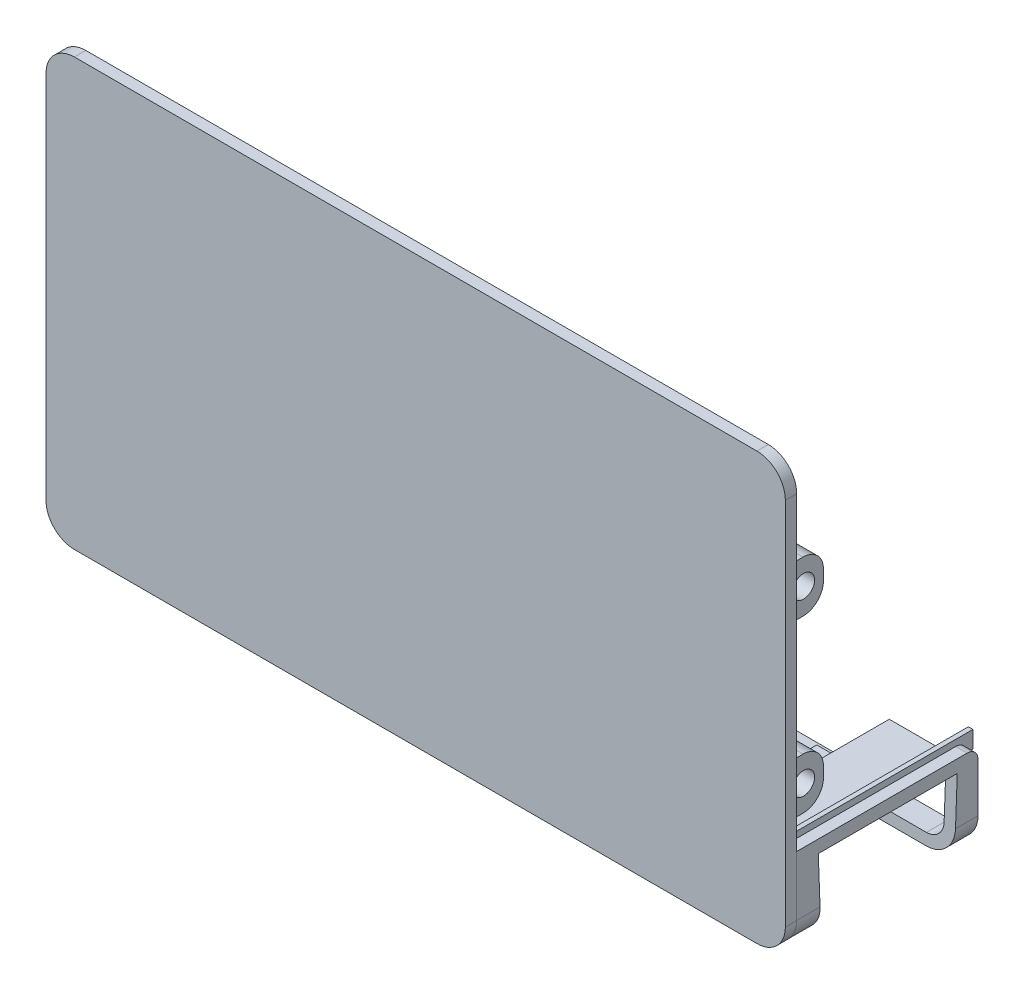
from build123d import *

# Parameters (mm, degrees)
FLAT_BOTTOM_COVER_T2_DEPTH           = 2
SKETCH_26_W                          = 6.4
SKETCH_26_H                          = 9
SIDE_LOCK_EARS_1_DEPTH               = 7
SKETCH_27_W                          = 6.4
SKETCH_27_H                          = 9
SIDE_LOCK_EARS_1_2_DEPTH             = 7
SKETCH_28_R                          = 1.45
SCREW_TIP_RELIEF_D2_9_1_DEPTH        = 5.6
SKETCH_29_R                          = 1.95
M2_5_HEATSET_D3_9_DEPTH3_5_1_DEPTH   = 3.5
SCREW_TIP_RELIEF_D2_9_1_START        = -5.6
SKETCH_30_R                          = 1.45
SCREW_TIP_RELIEF_D2_9_1_2_DEPTH      = 5.6
M2_5_HEATSET_D3_9_DEPTH3_5_1_START   = -3.5
SKETCH_31_R                          = 1.95
M2_5_HEATSET_D3_9_DEPTH3_5_1_2_DEPTH = 3.5
FILLET_1_R                           = 3.6
EXTRUDE_2_DEPTH                      = 31.9
FILLET_2_R                           = 1.9
CUT_EXTRUDE_1_DEPTH                  = 17
SKETCH_36_W                          = 10
SKETCH_36_H                          = 2.230124649
SKETCH_36_W_2                        = 7.730192546
SKETCH_36_H_2                        = 3.216563854
EXTRUDE_3_DEPTH                      = 28.3
SKETCH_38_R                          = 2
CUT_EXTRUDE_2_DEPTH                  = 3.4
SKETCH_39_W                          = 0.8
SKETCH_39_H                          = 3
EXTRUDE_4_DEPTH                      = 33
SKETCH_40_R                          = 1
CUT_EXTRUDE_3_DEPTH                  = 2
EXTRUDE_5_DEPTH                      = 1.5
SKETCH_42_W                          = 1.5
SKETCH_42_H                          = 31.9
EXTRUDE_6_DEPTH                      = 1.5
CHAMFER_1_SIZE                       = 1.5
SKETCH_43_W                          = 30
SKETCH_43_H                          = 10.5
CUT_EXTRUDE_4_DEPTH                  = 30


with BuildPart() as part:
    # 草图25 → Flat_bottom_cover_T2 (new body)
    with BuildSketch(Plane.XY):
        with BuildLine():
            Line((-60, -37.5), (60, -37.5))
            ThreePointArc((60, -37.5), (63.535533906, -36.035533906), (65, -32.5))
            Line((65, -32.5), (65, 32.5))
            ThreePointArc((65, 32.5), (63.535533906, 36.035533906), (60, 37.5))
            Line((60, 37.5), (-60, 37.5))
            ThreePointArc((-60, 37.5), (-63.535533906, 36.035533906), (-65, 32.5))
            Line((-65, 32.5), (-65, -32.5))
            ThreePointArc((-65, -32.5), (-63.535533906, -36.035533906), (-60, -37.5))
        make_face()
    extrude(amount=FLAT_BOTTOM_COVER_T2_DEPTH)

    # 草图26 → Side_lock_ears_-1 (add)
    with BuildSketch(Plane.XY):
        with Locations((-59.5, -14.5)):
            Rectangle(SKETCH_26_W, SKETCH_26_H)
        with Locations((-59.5, 15.5)):
            Rectangle(SKETCH_26_W, SKETCH_26_H)
    extrude(amount=-SIDE_LOCK_EARS_1_DEPTH)

    # 草图27 → Side_lock_ears_1 2 (add)
    with BuildSketch(Plane.XY):
        with Locations((59.5, -14.5)):
            Rectangle(SKETCH_27_W, SKETCH_27_H)
        with Locations((59.5, 15.5)):
            Rectangle(SKETCH_27_W, SKETCH_27_H)
    extrude(amount=-SIDE_LOCK_EARS_1_2_DEPTH)

    # 草图28 → Screw_tip_relief_D2.9_-1 (cut)
    with BuildSketch(Plane.ZY.offset(62.7)):
        with Locations((-3.5, -14.5)):
            Circle(SKETCH_28_R)
        with Locations((-3.5, 15.5)):
            Circle(SKETCH_28_R)
    extrude(amount=-SCREW_TIP_RELIEF_D2_9_1_DEPTH, mode=Mode.SUBTRACT)

    # 草图29 → M2.5_heatset_D3.9_depth3.5_-1 (cut)
    with BuildSketch(Plane.ZY.offset(62.7)):
        with Locations((-3.5, -14.5)):
            Circle(SKETCH_29_R)
        with Locations((-3.5, 15.5)):
            Circle(SKETCH_29_R)
    extrude(amount=-M2_5_HEATSET_D3_9_DEPTH3_5_1_DEPTH, mode=Mode.SUBTRACT)

    # 草图30 → Screw_tip_relief_D2.9_1 2 (cut)
    with BuildSketch(Plane(origin=(62.7, 0, 0), x_dir=(0, 0, -1), z_dir=(1, 0, 0)).offset(SCREW_TIP_RELIEF_D2_9_1_START)):
        with Locations(Location((3.5, -14.5, 0), (0, 0, 180))):
            Circle(SKETCH_30_R)
        with Locations(Location((3.5, 15.5, 0), (0, 0, 180))):
            Circle(SKETCH_30_R)
    extrude(amount=SCREW_TIP_RELIEF_D2_9_1_2_DEPTH, mode=Mode.SUBTRACT)

    # 草图31 → M2.5_heatset_D3.9_depth3.5_1 2 (cut)
    with BuildSketch(Plane(origin=(62.7, 0, 0), x_dir=(0, 0, -1), z_dir=(1, 0, 0)).offset(M2_5_HEATSET_D3_9_DEPTH3_5_1_START)):
        with Locations(Location((3.5, -14.5, 0), (0, 0, 180))):
            Circle(SKETCH_31_R)
        with Locations(Location((3.5, 15.5, 0), (0, 0, 180))):
            Circle(SKETCH_31_R)
    extrude(amount=M2_5_HEATSET_D3_9_DEPTH3_5_1_2_DEPTH, mode=Mode.SUBTRACT)

    # 圆角1
    fillet_1_edges = [part.edges().sort_by_distance(p)[0] for p in [
        (-59.5, -10, -7),
        (-59.5, -19, -7),
        (-59.5, 20, -7),
        (-59.5, 11, -7),
        (59.5, -10, -7),
        (59.5, -19, -7),
        (59.5, 20, -7),
        (59.5, 11, -7),
    ]]
    fillet(fillet_1_edges, radius=FILLET_1_R)

    # 草图34 → 凸台-拉伸2 (add)
    with BuildSketch(Plane(origin=(0, 0, 0), x_dir=(-1, 0, 0), z_dir=(0, 0, -1))):
        with BuildLine():
            Line((59.9, -37.5), (59.9, -35.5))
            Line((59.9, -35.5), (-59.974798431, -35.5))
            ThreePointArc((-59.974798431, -35.5), (-62.096118775, -34.621320344), (-62.974798431, -32.5))
            Line((-62.974798431, -32.5), (-62.974798431, -22))
            Line((-62.974798431, -22), (-64.974798431, -22))
            Line((-64.974798431, -22), (-64.974798431, -32.5))
            ThreePointArc((-64.974798431, -32.5), (-63.510332337, -36.035533906), (-59.974798431, -37.5))
            Line((-59.974798431, -37.5), (59.9, -37.5))
        make_face()
    extrude(amount=EXTRUDE_2_DEPTH)

    # 圆角2
    fillet_2_edges = [part.edges().sort_by_distance(p)[0] for p in [
        (-59.9, -36.5, -31.9),
        (63.974798431, -22, -31.9),
    ]]
    fillet(fillet_2_edges, radius=FILLET_2_R)

    # 草图35 → 切除-拉伸1 (cut)
    with BuildSketch(Plane(origin=(64.974798431, 0, 0), x_dir=(0, 0, -1), z_dir=(1, 0, 0))):
        Polygon((28.253330829, -24.230124649), (3.818816185, -24.230124649), (4.460921325, -41.414522636), (27.608915905, -41.414522636), align=None)
    extrude(amount=-CUT_EXTRUDE_1_DEPTH, mode=Mode.SUBTRACT)

    # 草图36 → 凸台-拉伸3 (add)
    with BuildSketch(Plane(origin=(0, 0, 0), x_dir=(-1, 0, 0), z_dir=(0, 0, -1))):
        with Locations((-57.974798431, -23.115062325)):
            Rectangle(SKETCH_36_W, SKETCH_36_H)
        with Locations((-44.107402927, -33.891718073)):
            Rectangle(SKETCH_36_W_2, SKETCH_36_H_2)
    extrude(amount=EXTRUDE_3_DEPTH)

    # 草图38 → 切除-拉伸2 (cut)
    with BuildSketch(Plane(origin=(0, -32.283436146, 0), x_dir=(1, 0, 0), z_dir=(0, 1, 0))):
        with Locations(Location((45.149848814, 23.990139143, 0), (0, 0, 270))):
            Circle(SKETCH_38_R)
        with Locations(Location((45.164981892, 7.990928305, 0), (0, 0, 270))):
            Circle(SKETCH_38_R)
    extrude(amount=-CUT_EXTRUDE_2_DEPTH, mode=Mode.SUBTRACT)

    # 草图39 → 凸台-拉伸4 (add)
    with BuildSketch(Plane(origin=(0, 0, 0), x_dir=(-1, 0, 0), z_dir=(0, 0, -1))):
        with BuildLine():
            Line((62.9, -32.5), (62.1, -32.5))
            ThreePointArc((62.1, -32.5), (61.48492424, -33.98492424), (60, -34.6))
            Line((60, -34.6), (58, -34.6))
            Line((58, -34.6), (58, -35.5))
            Line((58, -35.5), (59.9, -35.5))
            Line((59.9, -35.5), (59.9, -35.4))
            Line((59.9, -35.4), (60, -35.4))
            ThreePointArc((60, -35.4), (62.050609665, -34.550609665), (62.9, -32.5))
        make_face()
        with Locations((-62.574798431, -22.4)):
            Rectangle(SKETCH_39_W, SKETCH_39_H)
    extrude(amount=EXTRUDE_4_DEPTH)

    # 草图40 → 切除-拉伸3 (cut)
    with BuildSketch(Plane.XZ.offset(37.5)):
        with Locations(Location((21.974798431, -27.4, 0), (0, 0, 270))):
            Circle(SKETCH_40_R)
        with Locations(Location((17.974798431, -27.4, 0), (0, 0, 270))):
            Circle(SKETCH_40_R)
        with Locations(Location((13.974798431, -27.4, 0), (0, 0, 270))):
            Circle(SKETCH_40_R)
        with Locations(Location((9.974798431, -27.4, 0), (0, 0, 270))):
            Circle(SKETCH_40_R)
        with Locations(Location((5.974798431, -27.4, 0), (0, 0, 270))):
            Circle(SKETCH_40_R)
        with Locations(Location((1.974798431, -27.4, 0), (0, 0, 270))):
            Circle(SKETCH_40_R)
        with Locations(Location((-2.025201569, -27.4, 0), (0, 0, 270))):
            Circle(SKETCH_40_R)
        with Locations(Location((-6.025201569, -27.4, 0), (0, 0, 270))):
            Circle(SKETCH_40_R)
        with Locations(Location((-10.025201569, -27.4, 0), (0, 0, 270))):
            Circle(SKETCH_40_R)
        with Locations(Location((-14.025201569, -27.4, 0), (0, 0, 270))):
            Circle(SKETCH_40_R)
        with Locations(Location((-18.025201569, -27.4, 0), (0, 0, 270))):
            Circle(SKETCH_40_R)
        with Locations(Location((-22.025201569, -27.4, 0), (0, 0, 270))):
            Circle(SKETCH_40_R)
        with Locations(Location((-26.025201569, -27.4, 0), (0, 0, 270))):
            Circle(SKETCH_40_R)
        with Locations(Location((-30.025201569, -27.4, 0), (0, 0, 270))):
            Circle(SKETCH_40_R)
        with Locations(Location((-34.025201569, -27.4, 0), (0, 0, 270))):
            Circle(SKETCH_40_R)
        with Locations(Location((-38.025201569, -27.4, 0), (0, 0, 270))):
            Circle(SKETCH_40_R)
        with Locations(Location((-42.025201569, -27.4, 0), (0, 0, 270))):
            Circle(SKETCH_40_R)
        with Locations(Location((-46.025201569, -27.4, 0), (0, 0, 270))):
            Circle(SKETCH_40_R)
        with Locations(Location((-50.025201569, -27.4, 0), (0, 0, 270))):
            Circle(SKETCH_40_R)
        with Locations(Location((-54.025201569, -27.4, 0), (0, 0, 270))):
            Circle(SKETCH_40_R)
        with Locations(Location((17.974798431, -23.4, 0), (0, 0, 270))):
            Circle(SKETCH_40_R)
        with Locations(Location((13.974798431, -23.4, 0), (0, 0, 270))):
            Circle(SKETCH_40_R)
        with Locations(Location((9.974798431, -23.4, 0), (0, 0, 270))):
            Circle(SKETCH_40_R)
        with Locations(Location((5.974798431, -23.4, 0), (0, 0, 270))):
            Circle(SKETCH_40_R)
        with Locations(Location((1.974798431, -23.4, 0), (0, 0, 270))):
            Circle(SKETCH_40_R)
        with Locations(Location((-2.025201569, -23.4, 0), (0, 0, 270))):
            Circle(SKETCH_40_R)
        with Locations(Location((-6.025201569, -23.4, 0), (0, 0, 270))):
            Circle(SKETCH_40_R)
        with Locations(Location((-10.025201569, -23.4, 0), (0, 0, 270))):
            Circle(SKETCH_40_R)
        with Locations(Location((-14.025201569, -23.4, 0), (0, 0, 270))):
            Circle(SKETCH_40_R)
        with Locations(Location((-18.025201569, -23.4, 0), (0, 0, 270))):
            Circle(SKETCH_40_R)
        with Locations(Location((-22.025201569, -23.4, 0), (0, 0, 270))):
            Circle(SKETCH_40_R)
        with Locations(Location((-26.025201569, -23.4, 0), (0, 0, 270))):
            Circle(SKETCH_40_R)
        with Locations(Location((-30.025201569, -23.4, 0), (0, 0, 270))):
            Circle(SKETCH_40_R)
        with Locations(Location((-34.025201569, -23.4, 0), (0, 0, 270))):
            Circle(SKETCH_40_R)
        with Locations(Location((-38.025201569, -23.4, 0), (0, 0, 270))):
            Circle(SKETCH_40_R)
        with Locations(Location((-42.025201569, -23.4, 0), (0, 0, 270))):
            Circle(SKETCH_40_R)
        with Locations(Location((-46.025201569, -23.4, 0), (0, 0, 270))):
            Circle(SKETCH_40_R)
        with Locations(Location((-50.025201569, -23.4, 0), (0, 0, 270))):
            Circle(SKETCH_40_R)
        with Locations(Location((-54.025201569, -23.4, 0), (0, 0, 270))):
            Circle(SKETCH_40_R)
        with Locations(Location((17.974798431, -19.4, 0), (0, 0, 270))):
            Circle(SKETCH_40_R)
        with Locations(Location((13.974798431, -19.4, 0), (0, 0, 270))):
            Circle(SKETCH_40_R)
        with Locations(Location((9.974798431, -19.4, 0), (0, 0, 270))):
            Circle(SKETCH_40_R)
        with Locations(Location((5.974798431, -19.4, 0), (0, 0, 270))):
            Circle(SKETCH_40_R)
        with Locations(Location((1.974798431, -19.4, 0), (0, 0, 270))):
            Circle(SKETCH_40_R)
        with Locations(Location((-2.025201569, -19.4, 0), (0, 0, 270))):
            Circle(SKETCH_40_R)
        with Locations(Location((-6.025201569, -19.4, 0), (0, 0, 270))):
            Circle(SKETCH_40_R)
        with Locations(Location((-10.025201569, -19.4, 0), (0, 0, 270))):
            Circle(SKETCH_40_R)
        with Locations(Location((-14.025201569, -19.4, 0), (0, 0, 270))):
            Circle(SKETCH_40_R)
        with Locations(Location((-18.025201569, -19.4, 0), (0, 0, 270))):
            Circle(SKETCH_40_R)
        with Locations(Location((-22.025201569, -19.4, 0), (0, 0, 270))):
            Circle(SKETCH_40_R)
        with Locations(Location((-26.025201569, -19.4, 0), (0, 0, 270))):
            Circle(SKETCH_40_R)
        with Locations(Location((-30.025201569, -19.4, 0), (0, 0, 270))):
            Circle(SKETCH_40_R)
        with Locations(Location((-34.025201569, -19.4, 0), (0, 0, 270))):
            Circle(SKETCH_40_R)
        with Locations(Location((-38.025201569, -19.4, 0), (0, 0, 270))):
            Circle(SKETCH_40_R)
        with Locations(Location((-42.025201569, -19.4, 0), (0, 0, 270))):
            Circle(SKETCH_40_R)
        with Locations(Location((-46.025201569, -19.4, 0), (0, 0, 270))):
            Circle(SKETCH_40_R)
        with Locations(Location((-50.025201569, -19.4, 0), (0, 0, 270))):
            Circle(SKETCH_40_R)
        with Locations(Location((-54.025201569, -19.4, 0), (0, 0, 270))):
            Circle(SKETCH_40_R)
        with Locations(Location((17.974798431, -15.4, 0), (0, 0, 270))):
            Circle(SKETCH_40_R)
        with Locations(Location((13.974798431, -15.4, 0), (0, 0, 270))):
            Circle(SKETCH_40_R)
        with Locations(Location((9.974798431, -15.4, 0), (0, 0, 270))):
            Circle(SKETCH_40_R)
        with Locations(Location((5.974798431, -15.4, 0), (0, 0, 270))):
            Circle(SKETCH_40_R)
        with Locations(Location((1.974798431, -15.4, 0), (0, 0, 270))):
            Circle(SKETCH_40_R)
        with Locations(Location((-2.025201569, -15.4, 0), (0, 0, 270))):
            Circle(SKETCH_40_R)
        with Locations(Location((-6.025201569, -15.4, 0), (0, 0, 270))):
            Circle(SKETCH_40_R)
        with Locations(Location((-10.025201569, -15.4, 0), (0, 0, 270))):
            Circle(SKETCH_40_R)
        with Locations(Location((-14.025201569, -15.4, 0), (0, 0, 270))):
            Circle(SKETCH_40_R)
        with Locations(Location((-18.025201569, -15.4, 0), (0, 0, 270))):
            Circle(SKETCH_40_R)
        with Locations(Location((-22.025201569, -15.4, 0), (0, 0, 270))):
            Circle(SKETCH_40_R)
        with Locations(Location((-26.025201569, -15.4, 0), (0, 0, 270))):
            Circle(SKETCH_40_R)
        with Locations(Location((-30.025201569, -15.4, 0), (0, 0, 270))):
            Circle(SKETCH_40_R)
        with Locations(Location((-34.025201569, -15.4, 0), (0, 0, 270))):
            Circle(SKETCH_40_R)
        with Locations(Location((-38.025201569, -15.4, 0), (0, 0, 270))):
            Circle(SKETCH_40_R)
        with Locations(Location((-42.025201569, -15.4, 0), (0, 0, 270))):
            Circle(SKETCH_40_R)
        with Locations(Location((-46.025201569, -15.4, 0), (0, 0, 270))):
            Circle(SKETCH_40_R)
        with Locations(Location((-50.025201569, -15.4, 0), (0, 0, 270))):
            Circle(SKETCH_40_R)
        with Locations(Location((-54.025201569, -15.4, 0), (0, 0, 270))):
            Circle(SKETCH_40_R)
        with Locations(Location((17.974798431, -11.4, 0), (0, 0, 270))):
            Circle(SKETCH_40_R)
        with Locations(Location((13.974798431, -11.4, 0), (0, 0, 270))):
            Circle(SKETCH_40_R)
        with Locations(Location((9.974798431, -11.4, 0), (0, 0, 270))):
            Circle(SKETCH_40_R)
        with Locations(Location((5.974798431, -11.4, 0), (0, 0, 270))):
            Circle(SKETCH_40_R)
        with Locations(Location((1.974798431, -11.4, 0), (0, 0, 270))):
            Circle(SKETCH_40_R)
        with Locations(Location((-2.025201569, -11.4, 0), (0, 0, 270))):
            Circle(SKETCH_40_R)
        with Locations(Location((-6.025201569, -11.4, 0), (0, 0, 270))):
            Circle(SKETCH_40_R)
        with Locations(Location((-10.025201569, -11.4, 0), (0, 0, 270))):
            Circle(SKETCH_40_R)
        with Locations(Location((-14.025201569, -11.4, 0), (0, 0, 270))):
            Circle(SKETCH_40_R)
        with Locations(Location((-18.025201569, -11.4, 0), (0, 0, 270))):
            Circle(SKETCH_40_R)
        with Locations(Location((-22.025201569, -11.4, 0), (0, 0, 270))):
            Circle(SKETCH_40_R)
        with Locations(Location((-26.025201569, -11.4, 0), (0, 0, 270))):
            Circle(SKETCH_40_R)
        with Locations(Location((-30.025201569, -11.4, 0), (0, 0, 270))):
            Circle(SKETCH_40_R)
        with Locations(Location((-34.025201569, -11.4, 0), (0, 0, 270))):
            Circle(SKETCH_40_R)
        with Locations(Location((-38.025201569, -11.4, 0), (0, 0, 270))):
            Circle(SKETCH_40_R)
        with Locations(Location((-42.025201569, -11.4, 0), (0, 0, 270))):
            Circle(SKETCH_40_R)
        with Locations(Location((-46.025201569, -11.4, 0), (0, 0, 270))):
            Circle(SKETCH_40_R)
        with Locations(Location((-50.025201569, -11.4, 0), (0, 0, 270))):
            Circle(SKETCH_40_R)
        with Locations(Location((-54.025201569, -11.4, 0), (0, 0, 270))):
            Circle(SKETCH_40_R)
        with Locations(Location((21.974798431, -23.4, 0), (0, 0, 270))):
            Circle(SKETCH_40_R)
        with Locations(Location((21.974798431, -19.4, 0), (0, 0, 270))):
            Circle(SKETCH_40_R)
        with Locations(Location((21.974798431, -15.4, 0), (0, 0, 270))):
            Circle(SKETCH_40_R)
        with Locations(Location((21.974798431, -11.4, 0), (0, 0, 270))):
            Circle(SKETCH_40_R)
    extrude(amount=-CUT_EXTRUDE_3_DEPTH, mode=Mode.SUBTRACT)

    # 草图41 → 凸台-拉伸5 (add)
    with BuildSketch(Plane(origin=(16.474798431, 0, 0), x_dir=(0, 0, -1), z_dir=(1, 0, 0))):
        Polygon((26.445965436, -35.5), (37.16202958, -30.09944732), (38.266697666, -32.291388547), (31.9, -35.5), align=None)
    extrude(amount=EXTRUDE_5_DEPTH)

    # 草图42 → 凸台-拉伸6 (add)
    with BuildSketch(Plane(origin=(0, -35.5, 0), x_dir=(1, 0, 0), z_dir=(0, 1, 0))):
        with Locations((17.224798431, 15.95)):
            Rectangle(SKETCH_42_W, SKETCH_42_H)
        with Locations((-16.05, 15.95)):
            Rectangle(SKETCH_42_W, SKETCH_42_H)
        with Locations((-44.05, 15.95)):
            Rectangle(SKETCH_42_W, SKETCH_42_H)
    extrude(amount=EXTRUDE_6_DEPTH)

    # 倒角1
    chamfer_1_edges = [part.edges().sort_by_distance(p)[0] for p in [
        (-16.05, -34, -31.9),
        (-44.05, -34, -31.9),
    ]]
    chamfer(chamfer_1_edges, length=CHAMFER_1_SIZE)

    # 草图43 → 切除-拉伸4 (cut)
    with BuildSketch(Plane.XZ.offset(37.5)):
        with Locations((7.974798431, -4.05)):
            Rectangle(SKETCH_43_W, SKETCH_43_H)
    extrude(amount=-CUT_EXTRUDE_4_DEPTH, mode=Mode.SUBTRACT)


solid = part.part
